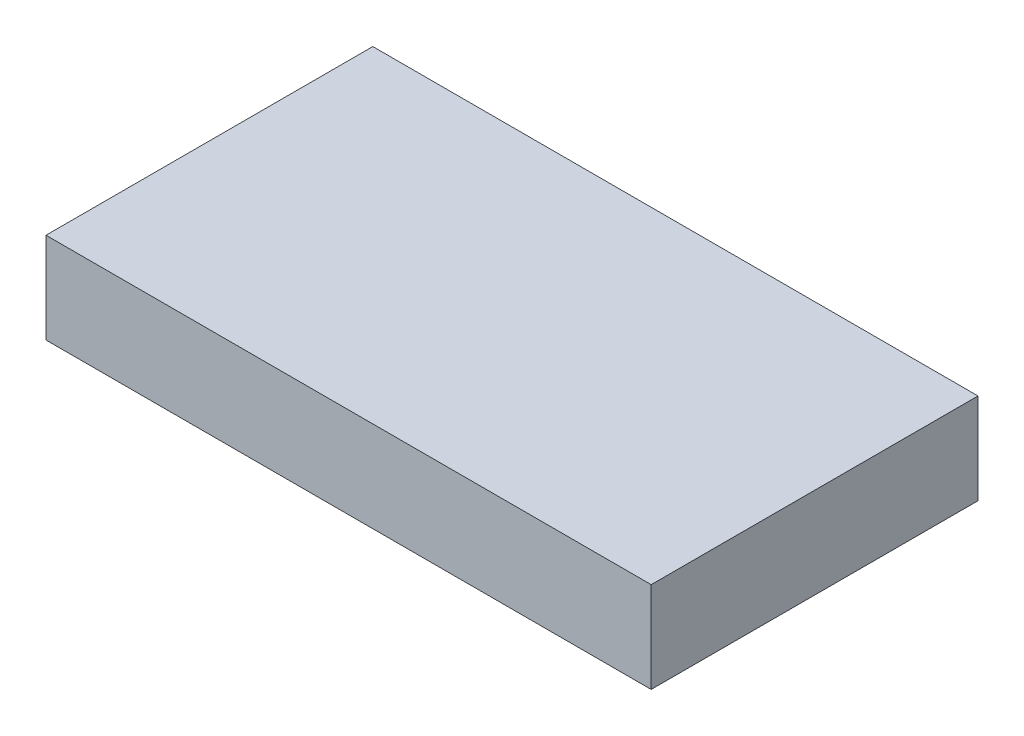
from build123d import *

# Parameters (mm, degrees)
SKETCH1_W           = 127
SKETCH1_H           = 68.58
BOSS_EXTRUDE1_DEPTH = 19.05


with BuildPart() as part:
    # Sketch1 → Boss-Extrude1 (new body)
    with BuildSketch(Plane(origin=(0, 0, 0), x_dir=(1, 0, 0), z_dir=(0, 1, 0))):
        with Locations((-26.975276695, 14.893600571)):
            Rectangle(SKETCH1_W, SKETCH1_H)
    extrude(amount=BOSS_EXTRUDE1_DEPTH)


solid = part.part
